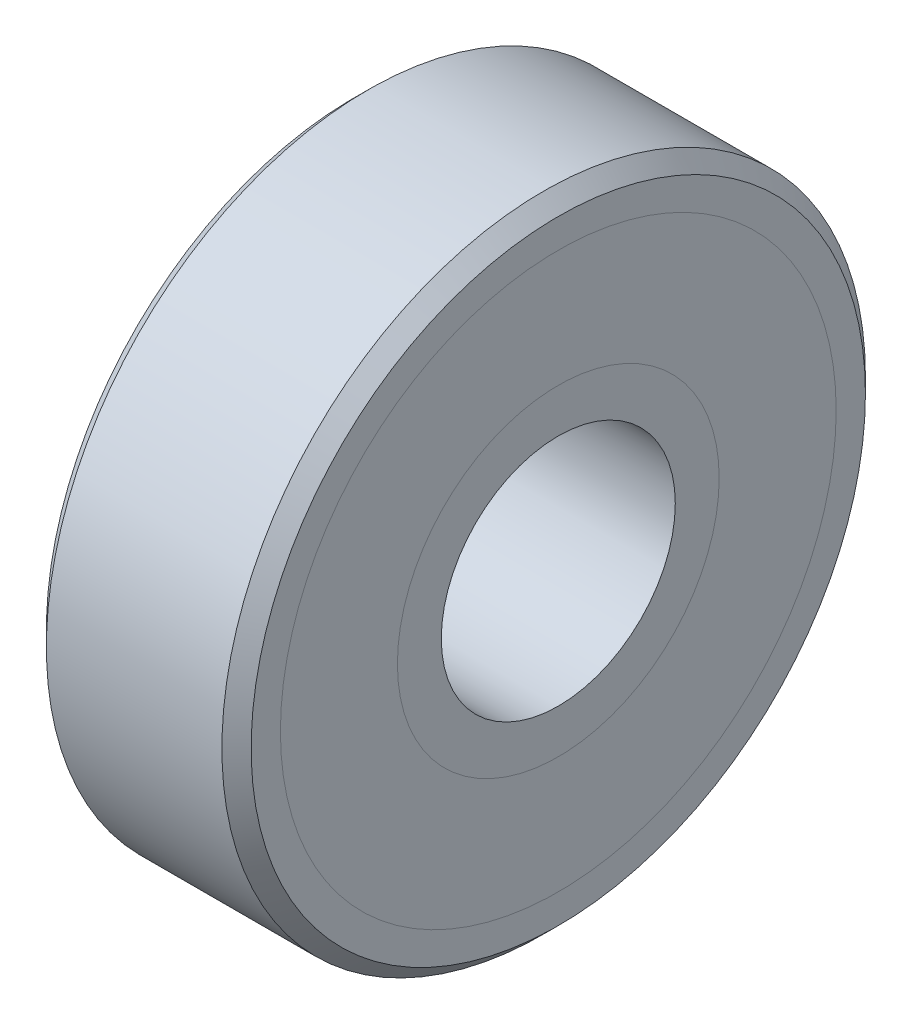
from build123d import *

# Parameters (mm, degrees)
SKETCH1_R           = 11
SKETCH1_R_2         = 4
BOSS_EXTRUDE1_DEPTH = 3.5
CHAMFER1_SIZE       = 0.5


with BuildPart() as part:
    # Sketch1 → Boss-Extrude1 (new, symmetric)
    with BuildSketch(Plane(origin=(0, 0, 0), x_dir=(0, 0, -1), z_dir=(1, 0, 0))):
        Circle(SKETCH1_R)
        Circle(SKETCH1_R_2, mode=Mode.SUBTRACT)
    extrude(amount=BOSS_EXTRUDE1_DEPTH, both=True)

    # Chamfer1
    chamfer1_edges = [part.edges().sort_by_distance(p)[0] for p in [
        (3.5, 0, 11),
        (-3.5, 0, 11),
    ]]
    chamfer(chamfer1_edges, length=CHAMFER1_SIZE)


solid = part.part
